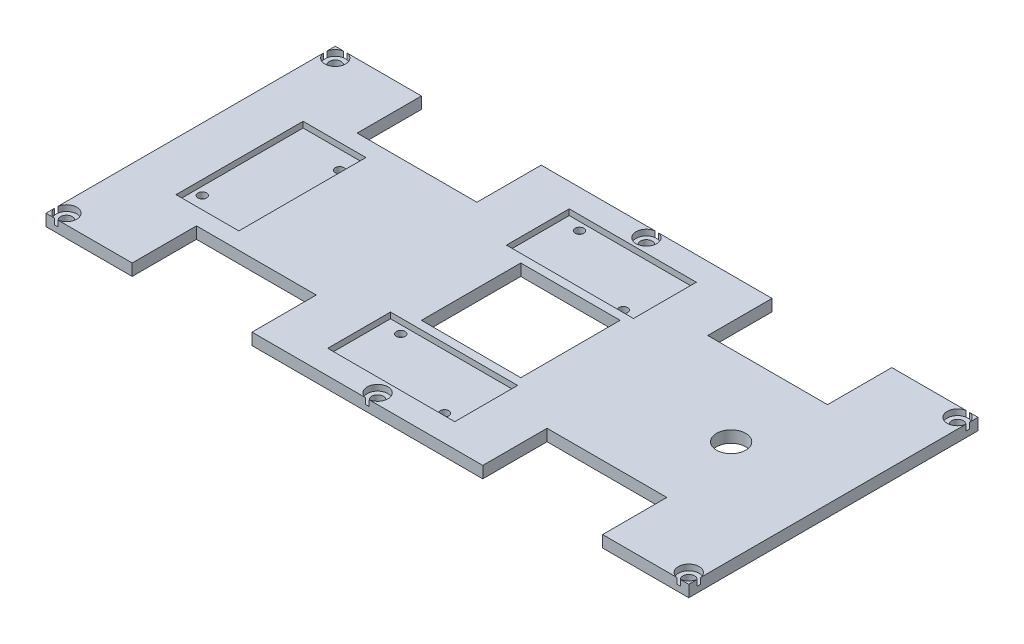
from build123d import *

# Parameters (mm, degrees)
EXTRUDE_1_DEPTH      = 4
SKETCH_11_R          = 2
SKETCH_11_R_2        = 5
SKETCH_11_W          = 34
SKETCH_11_H          = 34
CUT_EXTRUDE_8_DEPTH  = 121.690720439
SKETCH_12_R          = 3.55
CUT_EXTRUDE_9_DEPTH  = 2
SKETCH_13_W          = 21.5
SKETCH_13_H          = 43.5
SKETCH_13_W_2        = 43.5
SKETCH_13_H_2        = 21.5
CUT_EXTRUDE_10_DEPTH = 2
SKETCH_14_R          = 1.5
CUT_EXTRUDE_11_DEPTH = 121.640996349


with BuildPart() as part:
    # 草圖1 → 填料-伸長1 (new body)
    with BuildSketch(Plane(origin=(0, 0, 0), x_dir=(1, 0, 0), z_dir=(0, 1, 0))):
        Polygon((-39.5, 49.5), (39.5, 49.5), (39.5, 27.5), (80.5, 27.5), (80.5, 49.5), (110, 49.5), (110, -49.5), (80.5, -49.5), (80.5, -27.5), (39.5, -27.5), (39.5, -49.5), (-39.5, -49.5), (-39.5, -27.5), (-80.5, -27.5), (-80.5, -49.5), (-110, -49.5), (-110, 49.5), (-80.5, 49.5), (-80.5, 27.5), (-39.5, 27.5), align=None)
    extrude(amount=EXTRUDE_1_DEPTH)

    # 草圖11 → 除料-伸長8 (cut, through all)
    with BuildSketch(Plane(origin=(0, 0, 0), x_dir=(1, 0, 0), z_dir=(0, 1, 0))):
        with Locations(Location((-106.5, 46, 0), (0, 0, 270))):
            Circle(SKETCH_11_R)
        with Locations(Location((-2.39e-07, 46, 0), (0, 0, 270))):
            Circle(SKETCH_11_R)
        with Locations(Location((106.5, 46, 0), (0, 0, 270))):
            Circle(SKETCH_11_R)
        with Locations(Location((-2.39e-07, -46, 0), (0, 0, 90))):
            Circle(SKETCH_11_R)
        with Locations(Location((-106.5, -46, 0), (0, 0, 90))):
            Circle(SKETCH_11_R)
        with Locations(Location((106.5, -46, 0), (0, 0, 90))):
            Circle(SKETCH_11_R)
        with Locations(Location((75, 0, 0), (0, 0, 270))):
            Circle(SKETCH_11_R_2)
        with Locations((3, 0)):
            Rectangle(SKETCH_11_W, SKETCH_11_H)
    extrude(amount=CUT_EXTRUDE_8_DEPTH, mode=Mode.SUBTRACT)

    # 草圖12 → 除料-伸長9 (cut)
    with BuildSketch(Plane(origin=(0, 4, 0), x_dir=(1, 0, 0), z_dir=(0, 1, 0))):
        with Locations((-106.5, 46)):
            Circle(SKETCH_12_R)
        with Locations((-2.39e-07, 46)):
            Circle(SKETCH_12_R)
        with Locations((-2.39e-07, -46)):
            Circle(SKETCH_12_R)
        with Locations((-106.5, -46)):
            Circle(SKETCH_12_R)
        with Locations((106.5, -46)):
            Circle(SKETCH_12_R)
        with Locations((106.5, 46)):
            Circle(SKETCH_12_R)
    extrude(amount=-CUT_EXTRUDE_9_DEPTH, mode=Mode.SUBTRACT)

    # 草圖13 → 除料-伸長10 (cut)
    with BuildSketch(Plane(origin=(0, 4, 0), x_dir=(1, 0, 0), z_dir=(0, 1, 0))):
        with Locations((-82.5, 0)):
            Rectangle(SKETCH_13_W, SKETCH_13_H)
        with Locations((0, -30.588054748)):
            Rectangle(SKETCH_13_W_2, SKETCH_13_H_2)
        with Locations((0, 30.588054748)):
            Rectangle(SKETCH_13_W_2, SKETCH_13_H_2)
    extrude(amount=-CUT_EXTRUDE_10_DEPTH, mode=Mode.SUBTRACT)

    # 草圖14 → 除料-伸長11 (cut, through all)
    with BuildSketch(Plane(origin=(0, 2, 0), x_dir=(1, 0, 0), z_dir=(0, 1, 0))):
        with Locations(Location((-74.5, 15.5, 0), (0, 0, 270))):
            Circle(SKETCH_14_R)
        with Locations(Location((-90.5, -15.5, 0), (0, 0, 270))):
            Circle(SKETCH_14_R)
        with Locations(Location((-15.5, -22.588054748, 0), (0, 0, 90))):
            Circle(SKETCH_14_R)
        with Locations(Location((15.5, -38.588054748, 0), (0, 0, 90))):
            Circle(SKETCH_14_R)
        with Locations(Location((15.5, 22.588054748, 0), (0, 0, 90))):
            Circle(SKETCH_14_R)
        with Locations(Location((-15.5, 38.588054748, 0), (0, 0, 90))):
            Circle(SKETCH_14_R)
    extrude(amount=-CUT_EXTRUDE_11_DEPTH, mode=Mode.SUBTRACT)


solid = part.part
